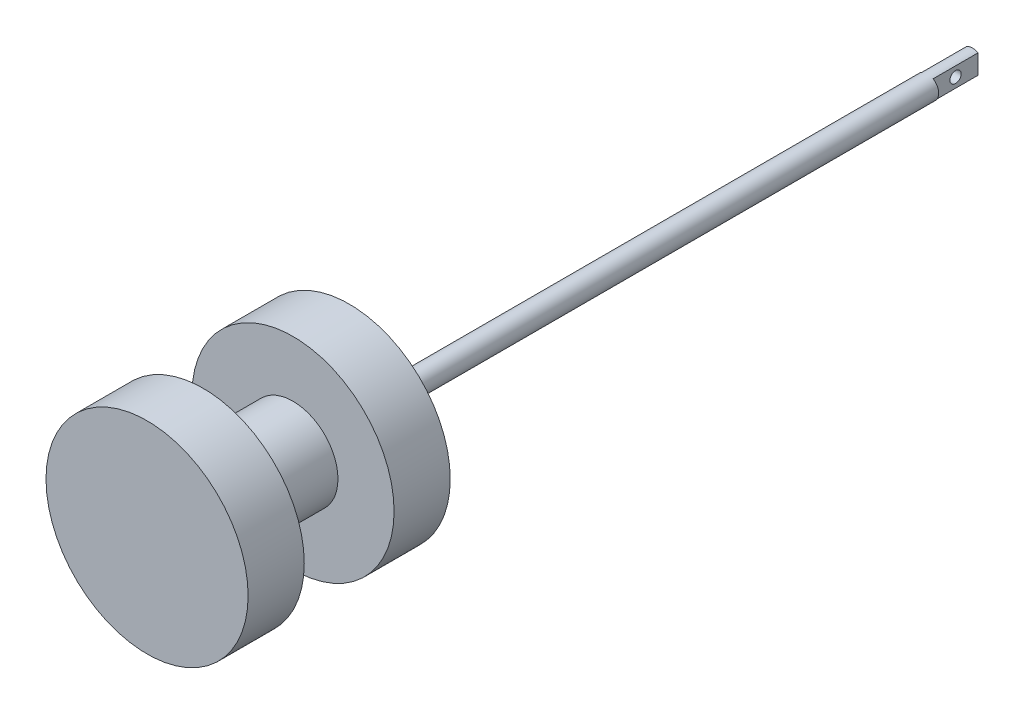
from build123d import *

# Parameters (mm, degrees)
SKETCH2_W          = 32.050318883
SKETCH2_H          = 65.476021051
SKETCH2_W_2        = 24.596756352
SKETCH2_H_2        = 67.490667853
CUT_EXTRUDE1_DEPTH = 100
CUT_EXTRUDE2_REACH = 1868.397
SKETCH3_R          = 12.5


with BuildPart() as part:
    # Sketch1 → Revolve1 (revolve)
    with BuildSketch(Plane(origin=(0, 0, 0), x_dir=(0, 0, -1), z_dir=(1, 0, 0)), mode=Mode.PRIVATE) as revolve1_sk:
        Polygon((0, 0), (1837.5, 0), (1837.5, -25), (450, -25), (450, -225), (325, -225), (325, -100), (125, -100), (125, -225), (0, -225), align=None)
    revolve(revolve1_sk.sketch.rotate(Axis((0, 0, 0), (0, 0, -1)), 270), axis=Axis((0, 0, 0), (0, 0, -1)))

    # Sketch2 → Cut-Extrude1 (cut)
    with BuildSketch(Plane(origin=(0, 0, -1837.5), x_dir=(-1, 0, 0), z_dir=(0, 0, -1))):
        with Locations((-28.525159442, 1.561413984)):
            Rectangle(SKETCH2_W, SKETCH2_H)
        with Locations((24.798378176, 2.232962919)):
            Rectangle(SKETCH2_W_2, SKETCH2_H_2)
    extrude(amount=-CUT_EXTRUDE1_DEPTH, mode=Mode.SUBTRACT)

    # Sketch3 → Cut-Extrude2 (cut, up to next)
    with BuildSketch(Plane(origin=(12.5, 0, 0), x_dir=(0, 0, -1), z_dir=(1, 0, 0)), mode=Mode.PRIVATE) as cut_extrude2_sk1:
        with Locations((1787.5, 0)):
            Circle(SKETCH3_R)
    cut_extrude2_tool1 = extrude(cut_extrude2_sk1.sketch, amount=-CUT_EXTRUDE2_REACH, mode=Mode.PRIVATE) & part.part
    add(cut_extrude2_tool1.solids().sort_by_distance((12.5, 0, -1787.5))[0], mode=Mode.SUBTRACT)


solid = part.part
